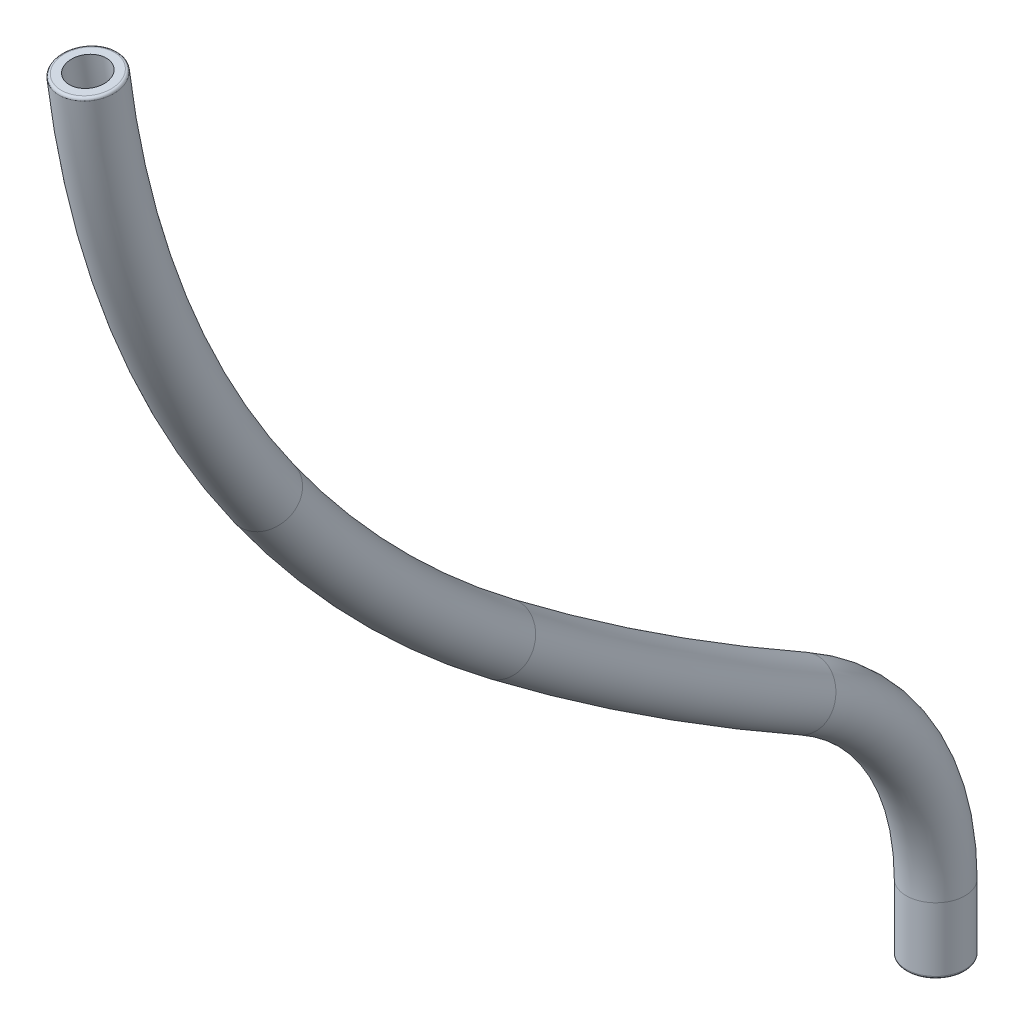
from build123d import *

# Parameters (mm, degrees)
CROQUIS11_R = 11
VACIADO5_T  = -4
REDONDEO3_R = 1


with BuildPart() as part:
    # Barrer4: sweep along a path in Croquis10
    with BuildLine(Plane(origin=(0, 0, 0), x_dir=(0, 0, -1), z_dir=(-1, 0, 0))) as barrer4_path:
        Line((0, 0), (0, -24.910858202))
        ThreePointArc((0, -24.910858202), (-13.332739449, -74.170158996), (-49.690658823, -109.979967076))
        ThreePointArc((-49.690658823, -109.979967076), (-107.587992383, -145.259844558), (-162.97033395, -184.369526621))
        ThreePointArc((-162.97033395, -184.369526621), (-210.828414492, -226.710036816), (-251.758207116, -275.780055692))
        ThreePointArc((-251.758207116, -275.780055692), (-295.61896572, -356.963847424), (-318.172480576, -446.439615948))
    # Croquis11 → Barrer4 (sweep)
    with BuildSketch(Plane(origin=(0, 0, 0), x_dir=(-1, 0, 0), z_dir=(0, 1, 0))):
        Circle(CROQUIS11_R)
    sweep(path=barrer4_path.line)

    # Vaciado5
    vaciado5_openings = [part.faces().sort_by_distance(p)[0] for p in [
        (0, 446.439615948, 318.172480576),
        (0, 0, 0),
    ]]
    offset(amount=VACIADO5_T, openings=vaciado5_openings, kind=Kind.INTERSECTION)

    # Redondeo3
    redondeo3_edges = [part.edges().sort_by_distance(p)[0] for p in [
        (11, 0, 0),
        (11, 446.439615948, 318.172480576),
    ]]
    fillet(redondeo3_edges, radius=REDONDEO3_R)


solid = part.part
